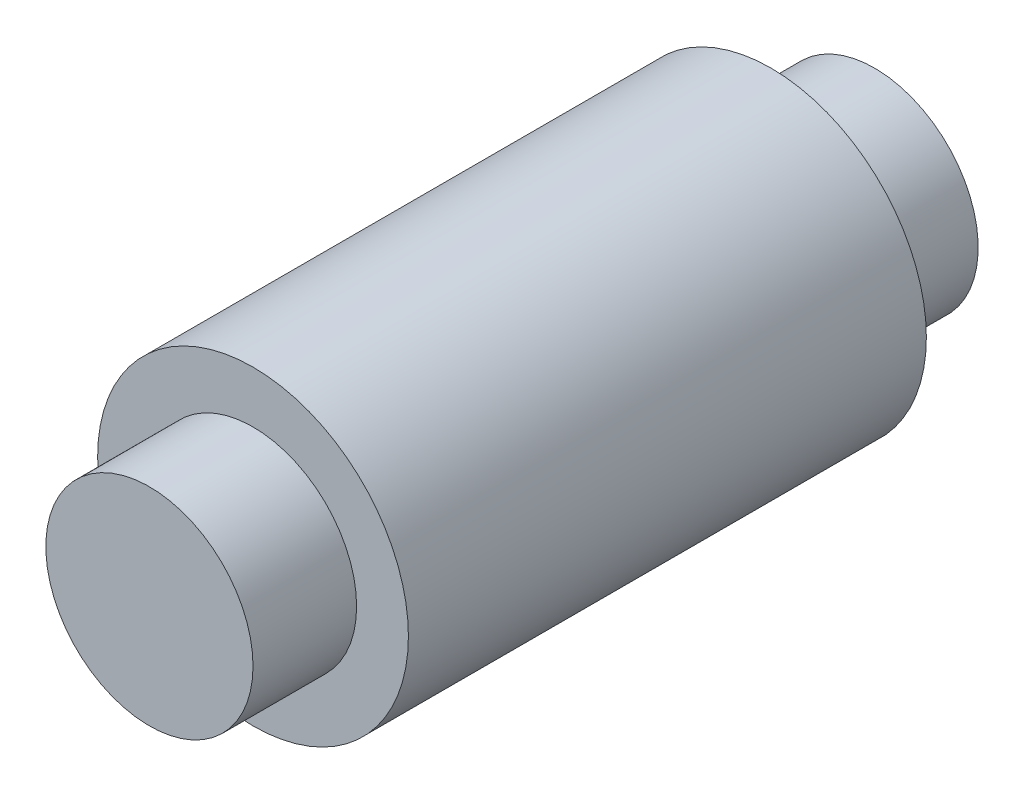
from build123d import *

# Parameters (mm, degrees)
SKETCH1_R           = 150
BOSS_EXTRUDE1_DEPTH = 500
SKETCH2_R           = 100
BOSS_EXTRUDE2_DEPTH = 100
BOSS_EXTRUDE3_START = 100
SKETCH3_R           = 100
BOSS_EXTRUDE3_DEPTH = 100


with BuildPart() as part:
    # Sketch1 → Boss-Extrude1 (new body)
    with BuildSketch(Plane.XY):
        Circle(SKETCH1_R)
    extrude(amount=BOSS_EXTRUDE1_DEPTH)

    # Sketch2 → Boss-Extrude2 (add)
    with BuildSketch(Plane.XY.offset(500)):
        Circle(SKETCH2_R)
    extrude(amount=BOSS_EXTRUDE2_DEPTH)

    # Sketch3 → Boss-Extrude3 (add)
    with BuildSketch(Plane(origin=(0, 0, 0), x_dir=(-1, 0, 0), z_dir=(0, 0, -1)).offset(BOSS_EXTRUDE3_START)):
        with Locations(Location((0, 0, 0), (0, 0, 180))):
            Circle(SKETCH3_R)
    extrude(amount=-BOSS_EXTRUDE3_DEPTH)


solid = part.part
